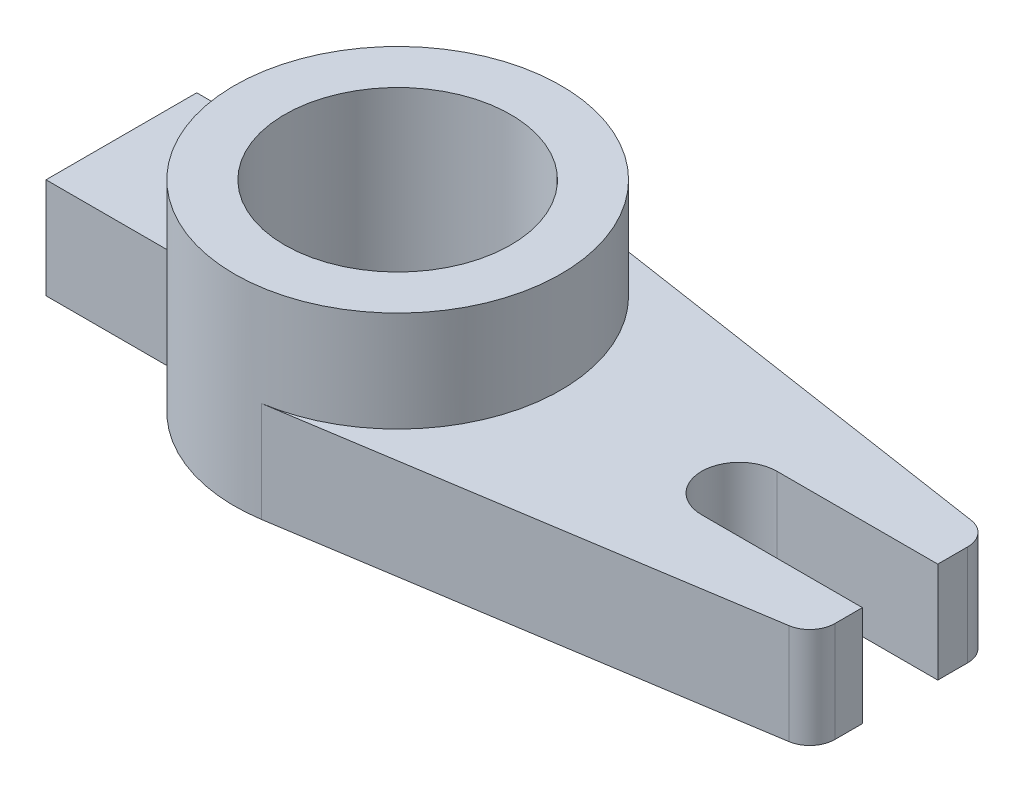
from build123d import *

# Parameters (mm, degrees)
DODANIE_WYCI_GNI_CIE1_DEPTH = 20
SZKIC1_R                    = 32.5
SZKIC1_R_2                  = 22.5
DODANIE_WYCI_GNI_CIE2_DEPTH = 40
DODANIE_WYCI_GNI_CIE3_DEPTH = 20


with BuildPart() as part:
    # Szkic3 → Dodanie-wyciągnięcie1 (new body)
    with BuildSketch(Plane(origin=(0, 0, 0), x_dir=(1, 0, 0), z_dir=(0, 1, 0))):
        with BuildLine():
            Line((4.860466255, 32.134496539), (95.747764039, 18.387443016))
            ThreePointArc((95.747764039, 18.387443016), (98.790700476, 16.704132859), (100, 13.443674318))
            Line((100, 13.443674318), (100, 7.5))
            Line((100, 7.5), (68, 7.5))
            ThreePointArc((68, 7.5), (60.5, 0), (68, -7.5))
            Line((68, -7.5), (100, -7.5))
            Line((100, -7.5), (100, -12.976912833))
            ThreePointArc((100, -12.976912833), (98.79887335, -16.227845203), (95.772575492, -17.91686497))
            Line((95.772575492, -17.91686497), (5.021740697, -32.109688886))
            ThreePointArc((5.021740697, -32.109688886), (32.499897597, 0.081585638), (4.860466255, 32.134496539))
        make_face()
    extrude(amount=DODANIE_WYCI_GNI_CIE1_DEPTH)

    # Szkic1 → Dodanie-wyciągnięcie2 (add)
    with BuildSketch(Plane(origin=(0, 0, 0), x_dir=(1, 0, 0), z_dir=(0, 1, 0))):
        with Locations(Location((0, 0, 0), (0, 0, 81.398987984))):
            Circle(SZKIC1_R)
        with Locations(Location((0, 0, 0), (0, 0, 270))):
            Circle(SZKIC1_R_2, mode=Mode.SUBTRACT)
    extrude(amount=DODANIE_WYCI_GNI_CIE2_DEPTH)

    # Szkic2 → Dodanie-wyciągnięcie3 (add)
    with BuildSketch(Plane(origin=(0, 0, 0), x_dir=(1, 0, 0), z_dir=(0, 1, 0))):
        with BuildLine():
            Line((-28.831406487, 15), (-55, 15))
            Line((-55, 15), (-55, -15))
            Line((-55, -15), (-28.831406487, -15))
            ThreePointArc((-28.831406487, -15), (-32.5, 0), (-28.831406487, 15))
        make_face()
    extrude(amount=DODANIE_WYCI_GNI_CIE3_DEPTH)


solid = part.part
